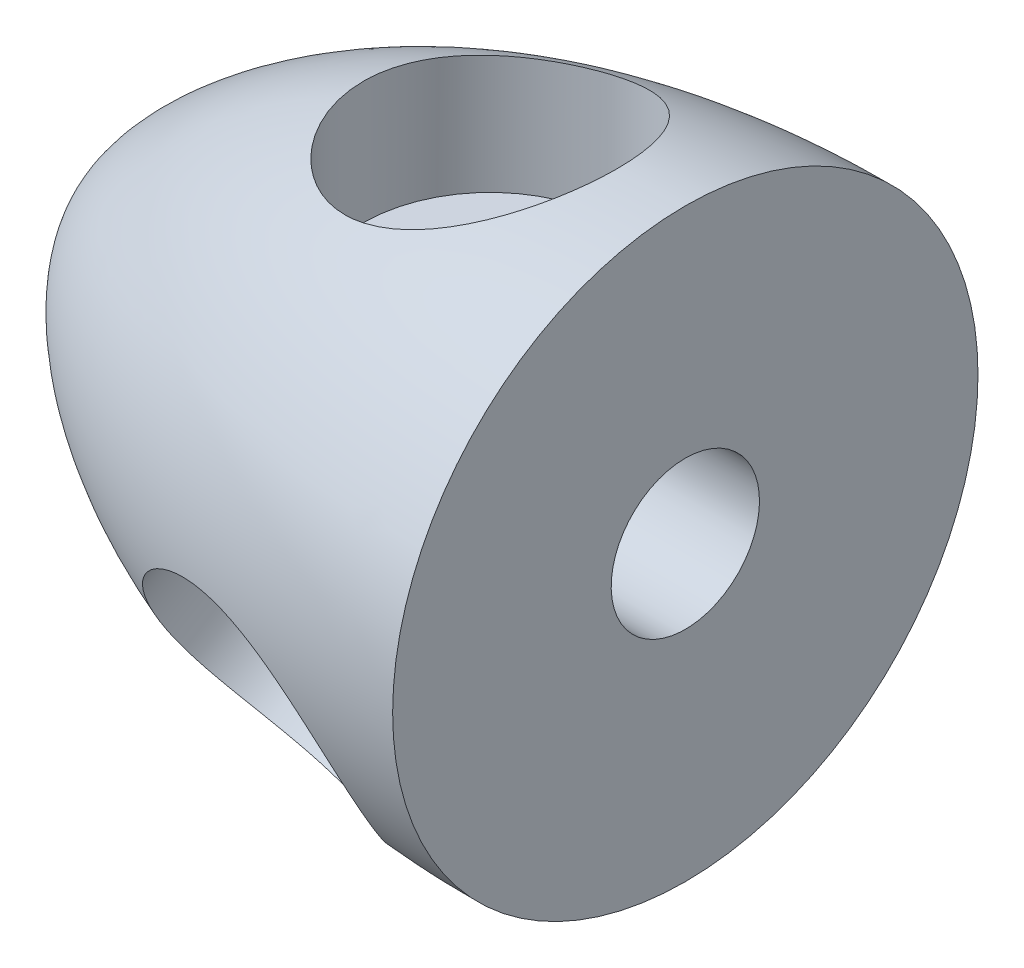
from build123d import *

# Parameters (mm, degrees)
SKETCH2_R          = 8.255
CUT_EXTRUDE1_DEPTH = 11.43
CIRPATTERN5_COUNT  = 3
SKETCH3_R          = 4.826
CUT_EXTRUDE2_DEPTH = 12.7


with BuildPart() as part:
    # Sketch1 → Revolve2 (revolve)
    with BuildSketch(Plane.XY):
        with BuildLine():
            Line((0, 19.05), (0, 0))
            Line((0, 0), (-38.1, 0))
            add(Edge.make_bspline(
                [(0, 19.05), (-25.41, 19.05), (-38.1, 6.316666667), (-38.1, 0)],
                knots=[0, 0, 0, 0, 1, 1, 1, 1], degree=3))
        make_face()
    revolve(axis=Axis((0, 0, 0), (-1, 0, 0)))

    # Sketch2 → Cut-Extrude1 (cut)
    with BuildSketch(Plane(origin=(0, 19.05, 0), x_dir=(1, 0, 0), z_dir=(0, 1, 0))):
        with Locations(Location((-12.7, 0, 0), (0, 0, 270))):
            Circle(SKETCH2_R)
    cut_extrude1 = extrude(amount=-CUT_EXTRUDE1_DEPTH, mode=Mode.SUBTRACT)

    # CirPattern5: Cut-Extrude1 ×3 about axis
    cirpattern5_axis = Axis((0, 0, 0), (1, 0, 0))
    for i in range(1, CIRPATTERN5_COUNT):
        add(cut_extrude1.rotate(cirpattern5_axis, i * 360 / CIRPATTERN5_COUNT), mode=Mode.SUBTRACT)

    # Sketch3 → Cut-Extrude2 (cut)
    with BuildSketch(Plane(origin=(0, 0, 0), x_dir=(0, 0, -1), z_dir=(1, 0, 0))):
        with Locations(Location((0, 0, 0), (0, 0, 90))):
            Circle(SKETCH3_R)
    extrude(amount=-CUT_EXTRUDE2_DEPTH, mode=Mode.SUBTRACT)


solid = part.part
